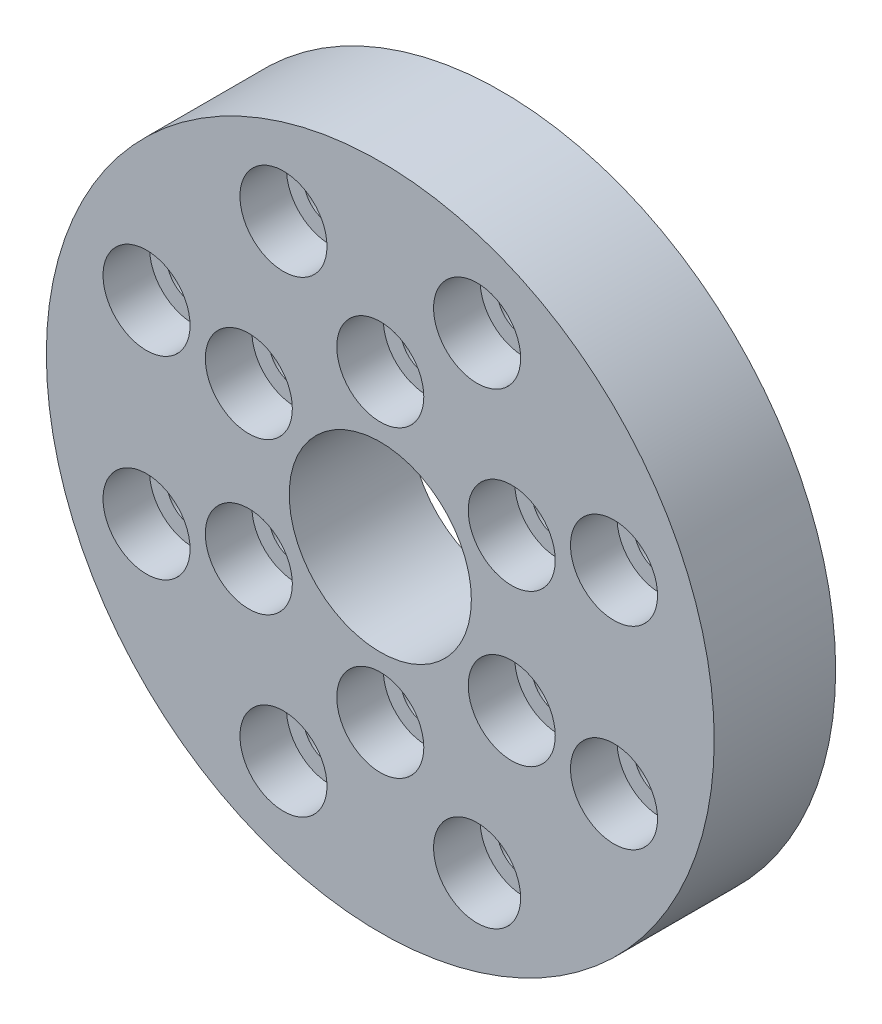
from build123d import *

# Parameters (mm, degrees)
SKETCH_1_R                = 16.5
SKETCH_1_R_2              = 4.5
EXTRUDE_1_DEPTH           = 6
HOLE_WIZARD_1_D           = 2.6
HOLE_WIZARD_1_CBORE_D     = 4.3
HOLE_WIZARD_1_CBORE_DEPTH = 2.3
PATTERN_CIRCULAR_1_COUNT  = 6
HOLE_WIZARD_2_D           = 2.6
HOLE_WIZARD_2_CBORE_D     = 4.3
HOLE_WIZARD_2_CBORE_DEPTH = 2.3
PATTERN_CIRCULAR_2_COUNT  = 8


with BuildPart() as part:
    # 草图1 → 凸台-拉伸1 (new body)
    with BuildSketch(Plane.XY):
        Circle(SKETCH_1_R)
        Circle(SKETCH_1_R_2, mode=Mode.SUBTRACT)
    extrude(amount=EXTRUDE_1_DEPTH)

    # 打孔尺寸(%根据)内六角圆柱头螺钉的类型1 (through all)
    with Locations(Plane.XY.offset(6)):
        with Locations((0, 7.5)):
            hole_wizard_1 = CounterBoreHole(HOLE_WIZARD_1_D / 2, HOLE_WIZARD_1_CBORE_D / 2, HOLE_WIZARD_1_CBORE_DEPTH)

    # 阵列(圆周)1: 打孔尺寸(%根据)内六角圆柱头螺钉的类型1 ×6 about axis
    pattern_circular_1_axis = Axis((0, 0, 6), (0, 0, -1))
    for i in range(1, PATTERN_CIRCULAR_1_COUNT):
        add(hole_wizard_1.rotate(pattern_circular_1_axis, i * 360 / PATTERN_CIRCULAR_1_COUNT), mode=Mode.SUBTRACT)

    # 打孔尺寸(%根据)内六角圆柱头螺钉的类型2 (through all)
    with Locations(Plane.XY.offset(6)):
        with Locations((-4.783542905, 11.548494156)):
            hole_wizard_2 = CounterBoreHole(HOLE_WIZARD_2_D / 2, HOLE_WIZARD_2_CBORE_D / 2, HOLE_WIZARD_2_CBORE_DEPTH)

    # 阵列(圆周)2: 打孔尺寸(%根据)内六角圆柱头螺钉的类型2 ×8 about axis
    pattern_circular_2_axis = Axis((0, 0, 6), (0, 0, -1))
    for i in range(1, PATTERN_CIRCULAR_2_COUNT):
        add(hole_wizard_2.rotate(pattern_circular_2_axis, i * 360 / PATTERN_CIRCULAR_2_COUNT), mode=Mode.SUBTRACT)


solid = part.part
